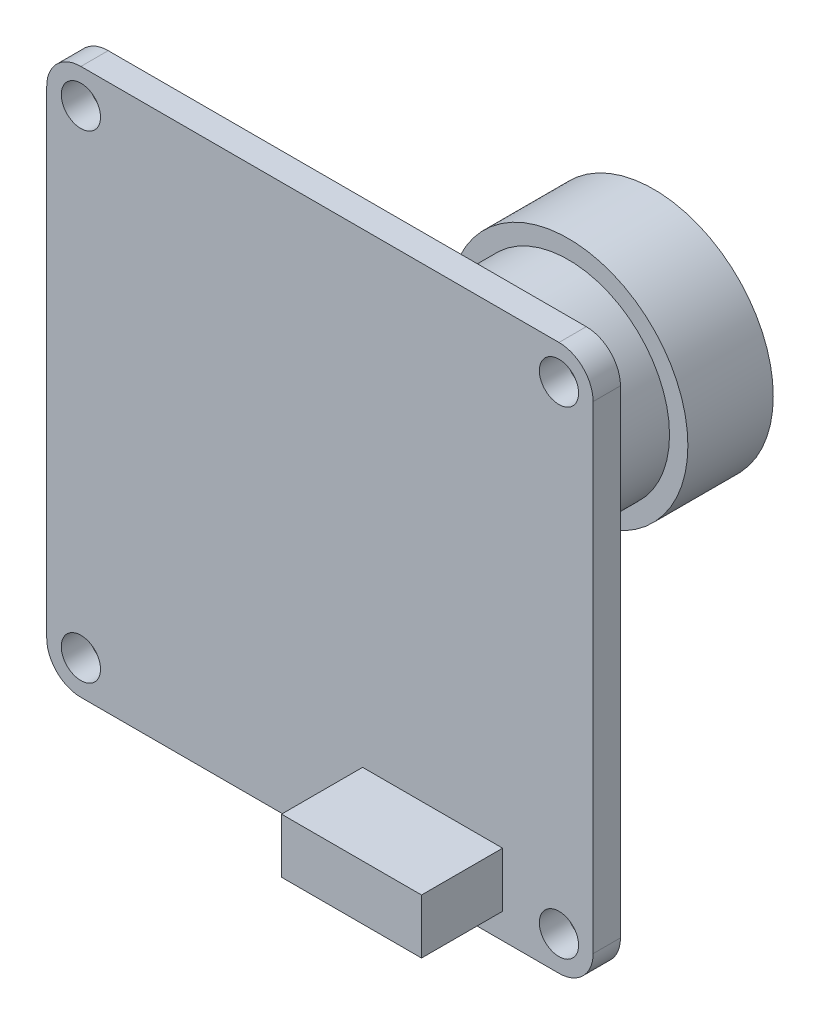
from build123d import *

# Parameters (mm, degrees)
SKETCH1_W           = 32
SKETCH1_H           = 32
SKETCH1_R           = 1.15
BOSS_EXTRUDE1_DEPTH = 1.6
FILLET1_R           = 2
BOSS_EXTRUDE2_DEPTH = 4
SKETCH1_4_R         = 6.5
BOSS_EXTRUDE3_DEPTH = 7.75
SKETCH3_W           = 8.2
SKETCH3_H           = 3.2
BOSS_EXTRUDE4_DEPTH = 4.75


with BuildPart() as part:
    # Sketch1 → Boss-Extrude1 (new body)
    with BuildSketch(Plane.XY):
        Rectangle(SKETCH1_W, SKETCH1_H)
        with Locations((-14, -14)):
            Circle(SKETCH1_R, mode=Mode.SUBTRACT)
        with Locations((14, -14)):
            Circle(SKETCH1_R, mode=Mode.SUBTRACT)
        with Locations((-14, 14)):
            Circle(SKETCH1_R, mode=Mode.SUBTRACT)
        with Locations((14, 14)):
            Circle(SKETCH1_R, mode=Mode.SUBTRACT)
    extrude(amount=BOSS_EXTRUDE1_DEPTH)

    # Fillet1
    fillet1_edges = [part.edges().sort_by_distance(p)[0] for p in [
        (16, 16, 0.8),
        (16, -16, 0.8),
        (-16, -16, 0.8),
        (-16, 16, 0.8),
    ]]
    fillet(fillet1_edges, radius=FILLET1_R)

    # Sketch1<3> → Boss-Extrude2 (add)
    with BuildSketch(Plane.XY):
        with BuildLine():
            Line((6.5, -6.5), (6.5, -2))
            Line((6.5, -2), (9, -2))
            ThreePointArc((9, -2), (11, 0), (9, 2))
            Line((9, 2), (6.5, 2))
            Line((6.5, 2), (6.5, 6.5))
            Line((6.5, 6.5), (-6.5, 6.5))
            Line((-6.5, 6.5), (-6.5, 2))
            Line((-6.5, 2), (-9, 2))
            ThreePointArc((-9, 2), (-11, 0), (-9, -2))
            Line((-9, -2), (-6.5, -2))
            Line((-6.5, -2), (-6.5, -6.5))
            Line((-6.5, -6.5), (6.5, -6.5))
        make_face()
    extrude(amount=-BOSS_EXTRUDE2_DEPTH)

    # Sketch1<4> → Boss-Extrude3 (add)
    with BuildSketch(Plane.XY):
        Circle(SKETCH1_4_R)
    extrude(amount=-BOSS_EXTRUDE3_DEPTH)

    # Sketch2 → Revolve1 (revolve)
    with BuildSketch(Plane(origin=(0, 0, 0), x_dir=(0, 0, -1), z_dir=(1, 0, 0))):
        Polygon((17.95, 0), (17.95, 7), (12.95, 7), (12.95, 5.925), (7.75, 5.925), (7.75, 0), align=None)
    revolve(axis=Axis((0, 0, 0), (0, 0, -1)))

    # Sketch3 → Boss-Extrude4 (add)
    with BuildSketch(Plane.XY.offset(1.6)):
        with Locations((6.6, -12.9)):
            Rectangle(SKETCH3_W, SKETCH3_H)
    extrude(amount=BOSS_EXTRUDE4_DEPTH)


solid = part.part
